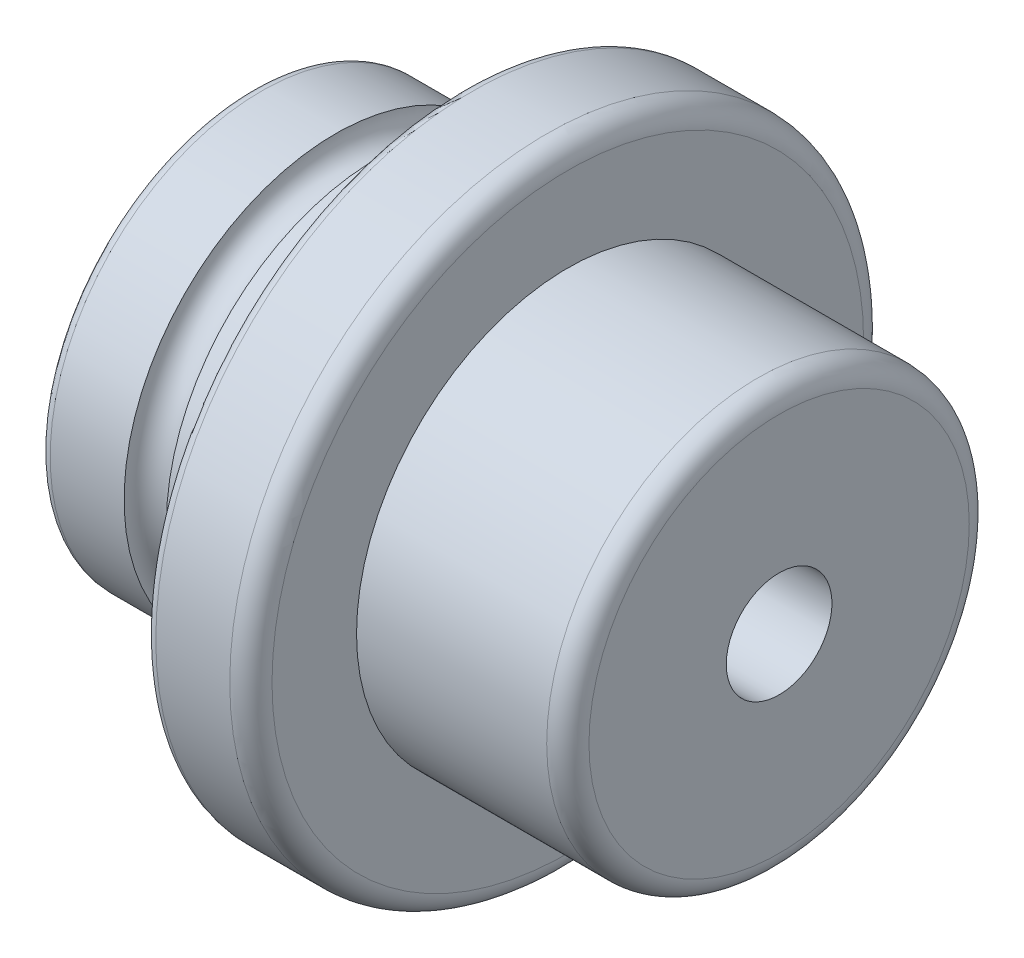
from build123d import *

# Parameters (mm, degrees)
SKICA2_R    = 2
ZAOBLIT8_R  = 1
ZAOBLIT9_R  = 1
ZAOBLIT10_R = 2
ZAOBLIT11_R = 2


with BuildPart() as part:
    # Skica1 → Rotovat1 (revolve)
    with BuildSketch(Plane.XY, mode=Mode.PRIVATE) as rotovat1_sk:
        Polygon((0, 5), (50, 5), (50, 20), (30, 20), (30, 30), (20, 30), (20, 20), (0, 20), align=None)
    revolve(rotovat1_sk.sketch.rotate(Axis((0, 0, 0), (1, 0, 0)), 90), axis=Axis((0, 0, 0), (1, 0, 0)))

    # Skica2 → Odebrat rotací1 (revolve, cut)
    with BuildSketch(Plane.XY, mode=Mode.PRIVATE) as odebrat_rotac_1_sk:
        with Locations((10, 20)):
            Circle(SKICA2_R)
    revolve(odebrat_rotac_1_sk.sketch.rotate(Axis((0, 0, 0), (-1, 0, 0)), 270), axis=Axis((0, 0, 0), (-1, 0, 0)), mode=Mode.SUBTRACT)

    # Zaoblit8
    zaoblit8_edges = [part.edges().sort_by_distance(p)[0] for p in [
        (0, 0, -20),
    ]]
    fillet(zaoblit8_edges, radius=ZAOBLIT8_R)

    # Zaoblit9
    zaoblit9_edges = [part.edges().sort_by_distance(p)[0] for p in [
        (20, 0, -30),
    ]]
    fillet(zaoblit9_edges, radius=ZAOBLIT9_R)

    # Zaoblit10
    zaoblit10_edges = [part.edges().sort_by_distance(p)[0] for p in [
        (30, 0, -30),
    ]]
    fillet(zaoblit10_edges, radius=ZAOBLIT10_R)

    # Zaoblit11
    zaoblit11_edges = [part.edges().sort_by_distance(p)[0] for p in [
        (50, 0, -20),
    ]]
    fillet(zaoblit11_edges, radius=ZAOBLIT11_R)


solid = part.part
